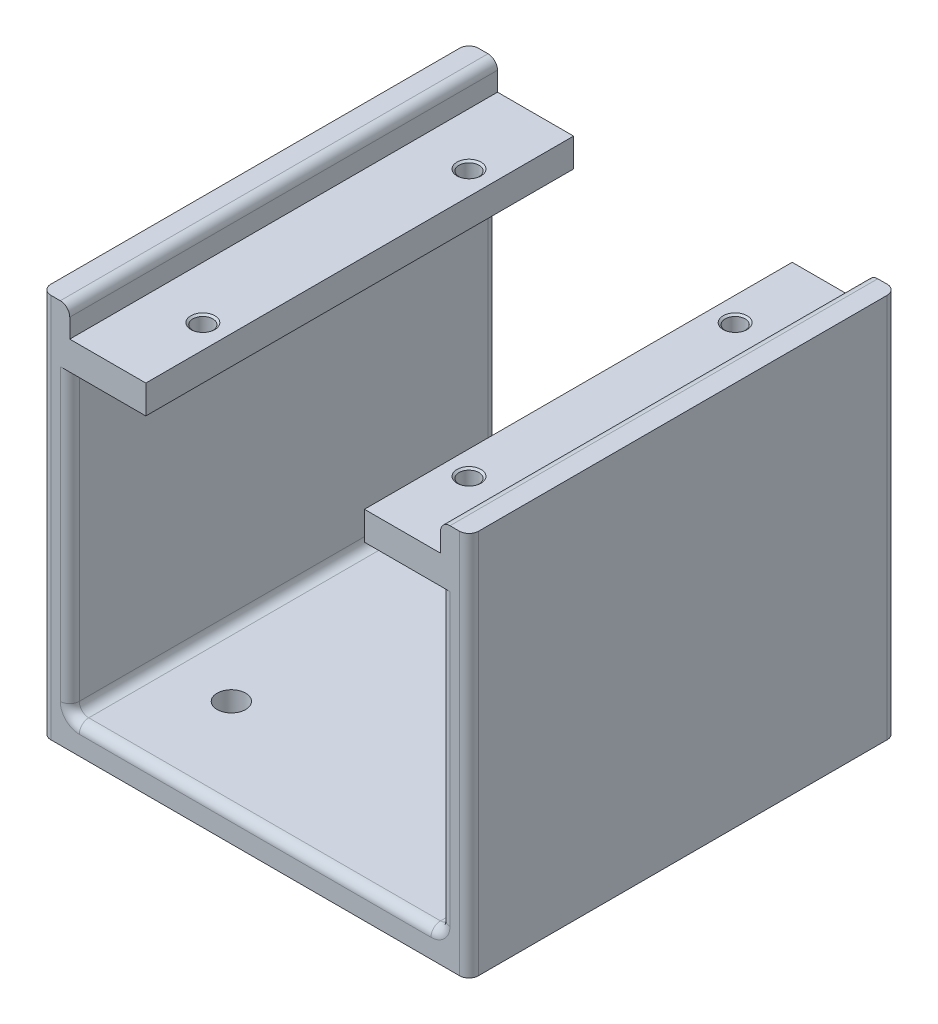
from build123d import *

# Parameters (mm, degrees)
SKETCH2_W                       = 90
SKETCH2_H                       = 90
BOSS_EXTRUDE1_DEPTH             = 6
SKETCH3_W                       = 6
SKETCH3_H                       = 90
BOSS_EXTRUDE2_DEPTH             = 75
SKETCH5_W                       = 90
SKETCH5_H                       = 6
BOSS_EXTRUDE3_DEPTH             = 16
SKETCH6_W                       = 90
SKETCH6_H                       = 6
BOSS_EXTRUDE4_DEPTH             = 16
CUT_EXTRUDE1_REACH              = 105.01
SKETCH7_R                       = 3
M5X0_8_TAPPED_HOLE2_D           = 4.2
M5X0_8_TAPPED_HOLE2_DEPTH       = 6
M5X0_8_TAPPED_HOLE2_CSINK_D     = 5.05
M5X0_8_TAPPED_HOLE2_CSINK_ANGLE = 100
FILLET2_R                       = 2


with BuildPart() as part:
    # Sketch2 → Boss-Extrude1 (new body)
    with BuildSketch(Plane(origin=(0, 0, 0), x_dir=(1, 0, 0), z_dir=(0, 1, 0))):
        Rectangle(SKETCH2_W, SKETCH2_H)
    extrude(amount=BOSS_EXTRUDE1_DEPTH)

    # Sketch3 → Boss-Extrude2 (add)
    with BuildSketch(Plane(origin=(0, 6, 0), x_dir=(1, 0, 0), z_dir=(0, 1, 0))):
        with Locations((-42, 0)):
            Rectangle(SKETCH3_W, SKETCH3_H)
        with Locations((42, 0)):
            Rectangle(SKETCH3_W, SKETCH3_H)
    extrude(amount=BOSS_EXTRUDE2_DEPTH)

    # Sketch5 → Boss-Extrude3 (add)
    with BuildSketch(Plane(origin=(-39, 0, 0), x_dir=(0, 0, -1), z_dir=(1, 0, 0))):
        with Locations((0, 72)):
            Rectangle(SKETCH5_W, SKETCH5_H)
    extrude(amount=BOSS_EXTRUDE3_DEPTH)

    # Sketch6 → Boss-Extrude4 (add)
    with BuildSketch(Plane.ZY.offset(-39)):
        with Locations((0, 72)):
            Rectangle(SKETCH6_W, SKETCH6_H)
    extrude(amount=BOSS_EXTRUDE4_DEPTH)

    # Sketch7 → Cut-Extrude1 (cut, up to next)
    with BuildSketch(Plane.XZ, mode=Mode.PRIVATE) as cut_extrude1_sk1:
        with Locations(Location((-25, 25, 0), (0, 0, 270))):
            Circle(SKETCH7_R)
    cut_extrude1_tool1 = extrude(cut_extrude1_sk1.sketch, amount=-CUT_EXTRUDE1_REACH, mode=Mode.PRIVATE) & part.part
    # Sketch7 → Cut-Extrude1 (cut, up to next)
    with BuildSketch(Plane.XZ, mode=Mode.PRIVATE) as cut_extrude1_sk2:
        with Locations(Location((25, 25, 0), (0, 0, 270))):
            Circle(SKETCH7_R)
    cut_extrude1_tool2 = extrude(cut_extrude1_sk2.sketch, amount=-CUT_EXTRUDE1_REACH, mode=Mode.PRIVATE) & part.part
    # Sketch7 → Cut-Extrude1 (cut, up to next)
    with BuildSketch(Plane.XZ, mode=Mode.PRIVATE) as cut_extrude1_sk3:
        with Locations(Location((25, -25, 0), (0, 0, 270))):
            Circle(SKETCH7_R)
    cut_extrude1_tool3 = extrude(cut_extrude1_sk3.sketch, amount=-CUT_EXTRUDE1_REACH, mode=Mode.PRIVATE) & part.part
    # Sketch7 → Cut-Extrude1 (cut, up to next)
    with BuildSketch(Plane.XZ, mode=Mode.PRIVATE) as cut_extrude1_sk4:
        with Locations(Location((-25, -25, 0), (0, 0, 270))):
            Circle(SKETCH7_R)
    cut_extrude1_tool4 = extrude(cut_extrude1_sk4.sketch, amount=-CUT_EXTRUDE1_REACH, mode=Mode.PRIVATE) & part.part
    add(cut_extrude1_tool1.solids().sort_by_distance((-25, 0, 25))[0], mode=Mode.SUBTRACT)
    add(cut_extrude1_tool2.solids().sort_by_distance((25, 0, 25))[0], mode=Mode.SUBTRACT)
    add(cut_extrude1_tool3.solids().sort_by_distance((25, 0, -25))[0], mode=Mode.SUBTRACT)
    add(cut_extrude1_tool4.solids().sort_by_distance((-25, 0, -25))[0], mode=Mode.SUBTRACT)

    # M5x0.8 Tapped Hole2
    with Locations(Plane(origin=(0, 75, 0), x_dir=(1, 0, 0), z_dir=(0, 1, 0))):
        with Locations((-28, 28), (-28, -28), (28, -28), (28, 28)):
            CounterSinkHole(M5X0_8_TAPPED_HOLE2_D / 2, M5X0_8_TAPPED_HOLE2_CSINK_D / 2, depth=M5X0_8_TAPPED_HOLE2_DEPTH, counter_sink_angle=M5X0_8_TAPPED_HOLE2_CSINK_ANGLE)

    # Fillet2
    fillet2_edges = [part.edges().sort_by_distance(p)[0] for p in [
        (-45, 40.5, 45),
        (-39, 37.5, 45),
        (0, 6, 45),
        (39, 37.5, 45),
        (45, 40.5, 45),
        (45, 40.5, -45),
        (39, 37.5, -45),
        (0, 6, -45),
        (-39, 37.5, -45),
        (-45, 40.5, -45),
        (39, 81, 0),
        (39, 6, 0),
        (-39, 6, 0),
        (-39, 81, 0),
    ]]
    fillet(fillet2_edges, radius=FILLET2_R)


solid = part.part
